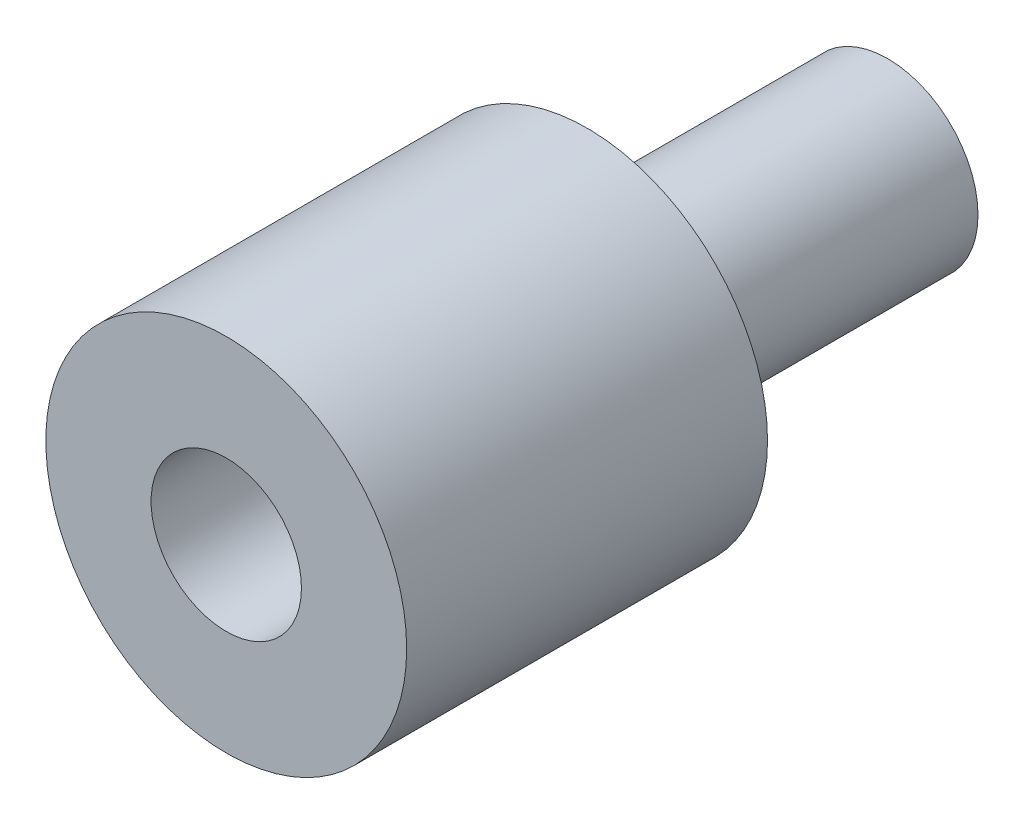
from build123d import *

# Parameters (mm, degrees)
SKETCH1_R           = 12
BOSS_EXTRUDE1_DEPTH = 24
SKETCH2_R           = 5
CUT_EXTRUDE1_DEPTH  = 12
SKETCH3_R           = 6
BOSS_EXTRUDE2_DEPTH = 20


with BuildPart() as part:
    # Sketch1 → Boss-Extrude1 (new body)
    with BuildSketch(Plane.XY):
        Circle(SKETCH1_R)
    extrude(amount=BOSS_EXTRUDE1_DEPTH)

    # Sketch2 → Cut-Extrude1 (cut)
    with BuildSketch(Plane.XY.offset(24)):
        Circle(SKETCH2_R)
    extrude(amount=-CUT_EXTRUDE1_DEPTH, mode=Mode.SUBTRACT)

    # Sketch3 → Boss-Extrude2 (add)
    with BuildSketch(Plane(origin=(0, 0, 0), x_dir=(-1, 0, 0), z_dir=(0, 0, -1))):
        Circle(SKETCH3_R)
    extrude(amount=BOSS_EXTRUDE2_DEPTH)


solid = part.part
